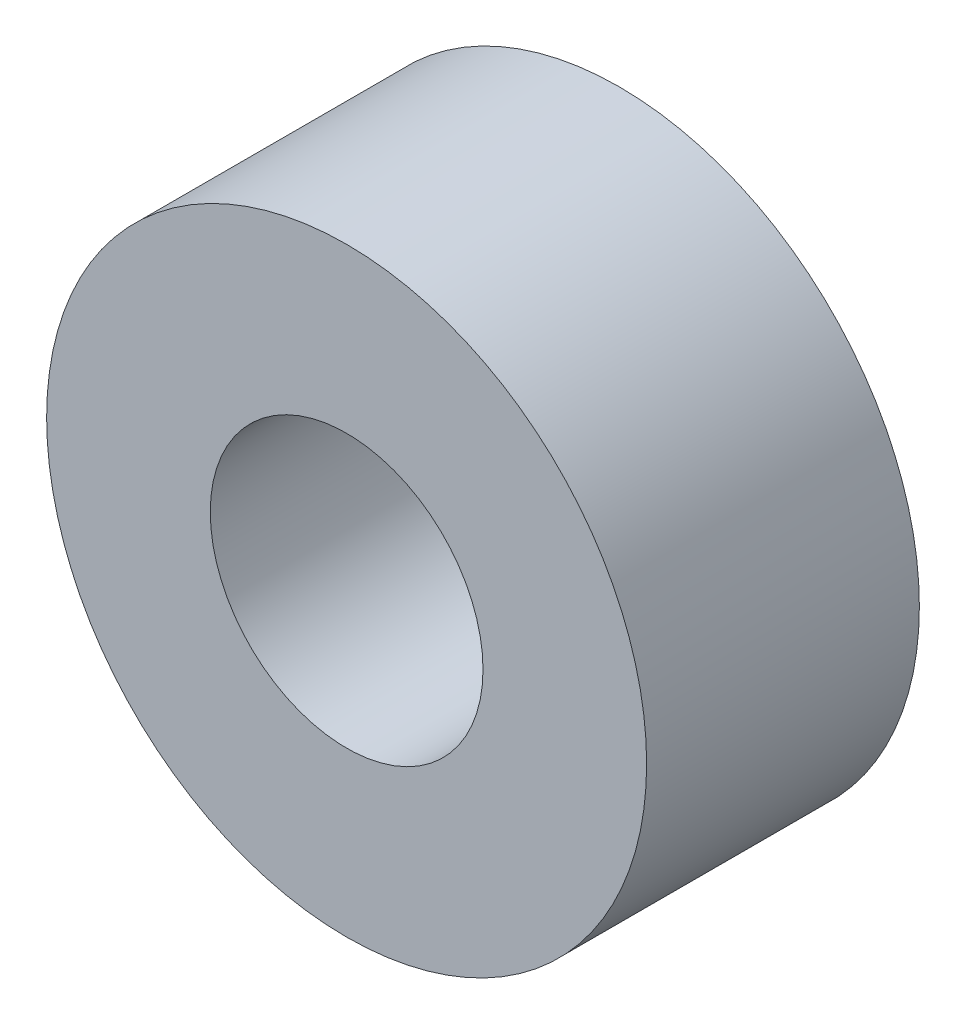
from build123d import *

# Parameters (mm, degrees)
SKIZZE1_R                       = 5.5
SKIZZE1_R_2                     = 2.5
AUFSATZ_LINEAR_AUSTRAGEN1_DEPTH = 5


with BuildPart() as part:
    # Skizze1 → Aufsatz-Linear austragen1 (new body)
    with BuildSketch(Plane.XY):
        Circle(SKIZZE1_R)
        Circle(SKIZZE1_R_2, mode=Mode.SUBTRACT)
    extrude(amount=AUFSATZ_LINEAR_AUSTRAGEN1_DEPTH)


solid = part.part
